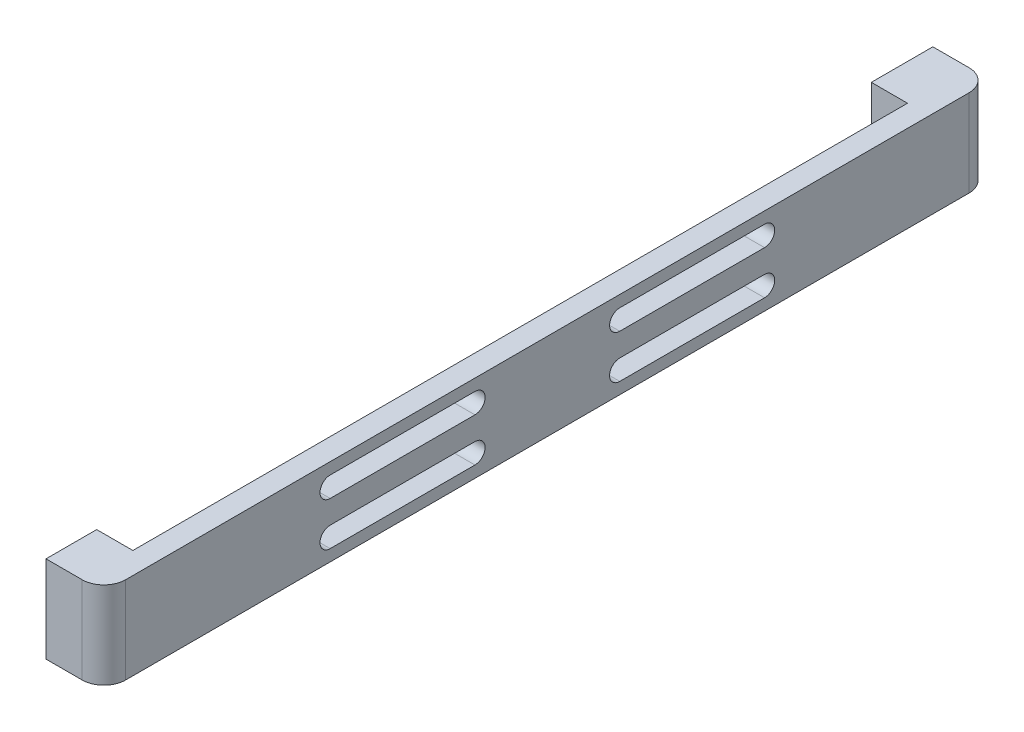
from build123d import *

# Parameters (mm, degrees)
SKETCH1_W             = 7
SKETCH1_H             = 12
BOSS_EXTRUDE1_DEPTH   = 5
SKETCH1_W_2           = 8.5
BOSS_EXTRUDE1_2_DEPTH = 5
SKETCH3_W             = 122.5
SKETCH3_H             = 12
BOSS_EXTRUDE2_DEPTH   = 3
SKETCH4_R             = 1.4
CUT_EXTRUDE1_DEPTH    = 3
FILLET1_R             = 3


with BuildPart() as part:
    # Sketch1 → Boss-Extrude1 (new body)
    with BuildSketch(Plane(origin=(0, 0, 0), x_dir=(0, 0, -1), z_dir=(1, 0, 0))):
        with Locations((-57, 0)):
            Rectangle(SKETCH1_W, SKETCH1_H)
    extrude(amount=BOSS_EXTRUDE1_DEPTH)



with BuildPart() as body_2:
    # Sketch1 → Boss-Extrude1 2 (new body)
    with BuildSketch(Plane(origin=(0, 0, 0), x_dir=(0, 0, -1), z_dir=(1, 0, 0))):
        with Locations((57.75, 0)):
            Rectangle(SKETCH1_W_2, SKETCH1_H)
    extrude(amount=BOSS_EXTRUDE1_2_DEPTH)


with BuildPart() as part_1:
    add(part.part)

    add(body_2.part)  # Boss-Extrude2 merges body 2
    # Sketch3 → Boss-Extrude2 (add)
    with BuildSketch(Plane(origin=(5, 0, 0), x_dir=(0, 0, -1), z_dir=(1, 0, 0))):
        with Locations((0.75, 0)):
            Rectangle(SKETCH3_W, SKETCH3_H)
    extrude(amount=BOSS_EXTRUDE2_DEPTH)

    # Sketch4 → Cut-Extrude1 (cut)
    with BuildSketch(Plane(origin=(8, 0, 0), x_dir=(0, 0, -1), z_dir=(1, 0, 0))):
        with BuildLine():
            Line((-19.25, 4.4), (-29.25, 4.4))
            ThreePointArc((-29.25, 4.4), (-30.65, 3), (-29.25, 1.6))
            Line((-29.25, 1.6), (-19.25, 1.6))
            ThreePointArc((-19.25, 1.6), (-20.65, 3), (-19.25, 4.4))
        make_face()
        with Locations((-19.25, 3)):
            Circle(SKETCH4_R)
        with BuildLine():
            Line((-9.25, 4.4), (-19.25, 4.4))
            ThreePointArc((-19.25, 4.4), (-18.260050506, 3.989949494), (-17.85, 3))
            ThreePointArc((-17.85, 3), (-18.260050506, 2.010050506), (-19.25, 1.6))
            Line((-19.25, 1.6), (-9.25, 1.6))
            ThreePointArc((-9.25, 1.6), (-7.85, 3), (-9.25, 4.4))
        make_face()
        with BuildLine():
            Line((-9.25, -1.6), (-19.250000006, -1.6))
            ThreePointArc((-19.250000006, -1.6), (-18.260050509, -2.010050504), (-17.85, -3))
            ThreePointArc((-17.85, -3), (-18.260050506, -3.989949494), (-19.25, -4.4))
            Line((-19.25, -4.4), (-9.25, -4.4))
            ThreePointArc((-9.25, -4.4), (-7.85, -3), (-9.25, -1.6))
        make_face()
        with Locations((-19.25, -3)):
            Circle(SKETCH4_R)
        with BuildLine():
            Line((-19.250000006, -1.6), (-29.25, -1.6))
            ThreePointArc((-29.25, -1.6), (-30.65, -3), (-29.25, -4.4))
            Line((-29.25, -4.4), (-19.25, -4.4))
            ThreePointArc((-19.25, -4.4), (-20.65, -3.000000003), (-19.250000006, -1.6))
        make_face()
        with BuildLine():
            Line((10.75, -4.4), (20.75, -4.4))
            ThreePointArc((20.75, -4.4), (19.35, -3), (20.75, -1.6))
            Line((20.75, -1.6), (10.75, -1.6))
            ThreePointArc((10.75, -1.6), (9.35, -3), (10.75, -4.4))
        make_face()
        with BuildLine():
            Line((10.75, 1.6), (20.75, 1.6))
            ThreePointArc((20.75, 1.6), (19.35, 2.999999987), (20.749999974, 4.4))
            Line((20.749999974, 4.4), (10.75, 4.4))
            ThreePointArc((10.75, 4.4), (9.35, 3), (10.75, 1.6))
        make_face()
        with Locations((20.75, 3)):
            Circle(SKETCH4_R)
        with BuildLine():
            Line((20.75, 1.6), (30.75, 1.6))
            ThreePointArc((30.75, 1.6), (32.15, 3), (30.75, 4.4))
            Line((30.75, 4.4), (20.749999974, 4.4))
            ThreePointArc((20.749999974, 4.4), (21.739949484, 3.989949503), (22.15, 3))
            ThreePointArc((22.15, 3), (21.739949494, 2.010050506), (20.75, 1.6))
        make_face()
        with BuildLine():
            Line((20.75, -4.4), (30.75, -4.4))
            ThreePointArc((30.75, -4.4), (32.15, -3), (30.75, -1.6))
            Line((30.75, -1.6), (20.75, -1.6))
            ThreePointArc((20.75, -1.6), (21.739949494, -2.010050506), (22.15, -3))
            ThreePointArc((22.15, -3), (21.739949494, -3.989949494), (20.75, -4.4))
        make_face()
        with Locations((20.75, -3)):
            Circle(SKETCH4_R)
    extrude(amount=-CUT_EXTRUDE1_DEPTH, mode=Mode.SUBTRACT)

    # Fillet1
    fillet1_edges = [part_1.edges().sort_by_distance(p)[0] for p in [
        (8, 0, 60.5),
        (8, 0, -62),
    ]]
    fillet(fillet1_edges, radius=FILLET1_R)


solid = part_1.part
